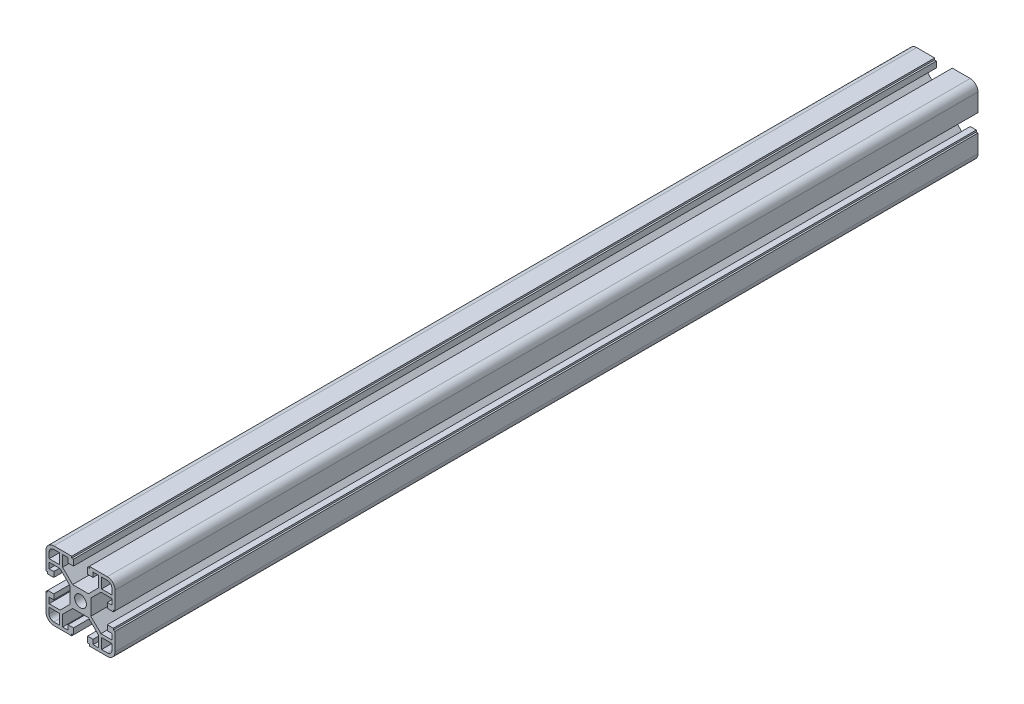
from build123d import *

# Parameters (mm, degrees)
SKETCH3_R           = 3.4
BOSS_EXTRUDE1_DEPTH = 500


with BuildPart() as part:
    # Sketch3 → Boss-Extrude1 (new body)
    with BuildSketch(Plane.XY):
        with BuildLine():
            Line((-11.814213562, 10.4), (-6, 4.585786438))
            Line((-6, 4.585786438), (-6, -4.585786438))
            Line((-6, -4.585786438), (-11.814213562, -10.4))
            Line((-11.814213562, -10.4), (-18.2, -10.4))
            Line((-18.2, -10.4), (-18.2, -7.1))
            Line((-18.2, -7.1), (-15.5, -7.1))
            Line((-15.5, -7.1), (-15.5, -4.1))
            Line((-15.5, -4.1), (-19, -4.1))
            Line((-19, -4.1), (-19, -5.1))
            Line((-19, -5.1), (-20, -5.1))
            Line((-20, -5.1), (-20, -15.5))
            ThreePointArc((-20, -15.5), (-18.681980515, -18.681980515), (-15.5, -20))
            Line((-15.5, -20), (-5.1, -20))
            Line((-5.1, -20), (-5.1, -19))
            Line((-5.1, -19), (-4.1, -19))
            Line((-4.1, -19), (-4.1, -15.5))
            Line((-4.1, -15.5), (-7.258114106, -15.5))
            Line((-7.258114106, -15.5), (-7.258114106, -18.2))
            Line((-7.258114106, -18.2), (-10.4, -18.2))
            Line((-10.4, -18.2), (-10.4, -11.814213562))
            Line((-10.4, -11.814213562), (-4.585786438, -6))
            Line((-4.585786438, -6), (4.585786438, -6))
            Line((4.585786438, -6), (10.4, -11.814213562))
            Line((10.4, -11.814213562), (10.4, -18.2))
            Line((10.4, -18.2), (7.258114106, -18.2))
            Line((7.258114106, -18.2), (7.258114106, -15.5))
            Line((7.258114106, -15.5), (4.1, -15.5))
            Line((4.1, -15.5), (4.1, -19))
            Line((4.1, -19), (5.1, -19))
            Line((5.1, -19), (5.1, -20))
            Line((5.1, -20), (15.5, -20))
            ThreePointArc((15.5, -20), (18.681980515, -18.681980515), (20, -15.5))
            Line((20, -15.5), (20, -5.1))
            Line((20, -5.1), (19, -5.1))
            Line((19, -5.1), (19, -4.1))
            Line((19, -4.1), (15.5, -4.1))
            Line((15.5, -4.1), (15.5, -7.1))
            Line((15.5, -7.1), (18.2, -7.1))
            Line((18.2, -7.1), (18.2, -10.4))
            Line((18.2, -10.4), (11.814213562, -10.4))
            Line((11.814213562, -10.4), (6, -4.585786438))
            Line((6, -4.585786438), (6, 4.585786438))
            Line((6, 4.585786438), (11.814213562, 10.4))
            Line((11.814213562, 10.4), (18.2, 10.4))
            Line((18.2, 10.4), (18.2, 7.1))
            Line((18.2, 7.1), (15.5, 7.1))
            Line((15.5, 7.1), (15.5, 4.1))
            Line((15.5, 4.1), (19, 4.1))
            Line((19, 4.1), (19, 5.1))
            Line((19, 5.1), (20, 5.1))
            Line((20, 5.1), (20, 15.5))
            ThreePointArc((20, 15.5), (18.681980515, 18.681980515), (15.5, 20))
            Line((15.5, 20), (5.1, 20))
            Line((5.1, 20), (5.1, 19))
            Line((5.1, 19), (4.1, 19))
            Line((4.1, 19), (4.1, 15.5))
            Line((4.1, 15.5), (7.258114106, 15.5))
            Line((7.258114106, 15.5), (7.258114106, 18.2))
            Line((7.258114106, 18.2), (10.4, 18.2))
            Line((10.4, 18.2), (10.4, 11.814213562))
            Line((10.4, 11.814213562), (4.585786438, 6))
            Line((4.585786438, 6), (-4.585786438, 6))
            Line((-4.585786438, 6), (-10.4, 11.814213562))
            Line((-10.4, 11.814213562), (-10.4, 18.2))
            Line((-10.4, 18.2), (-7.258114106, 18.2))
            Line((-7.258114106, 18.2), (-7.258114106, 15.5))
            Line((-7.258114106, 15.5), (-4.1, 15.5))
            Line((-4.1, 15.5), (-4.1, 19))
            Line((-4.1, 19), (-5.1, 19))
            Line((-5.1, 19), (-5.1, 20))
            Line((-5.1, 20), (-15.5, 20))
            ThreePointArc((-15.5, 20), (-18.681980515, 18.681980515), (-20, 15.5))
            Line((-20, 15.5), (-20, 5.1))
            Line((-20, 5.1), (-19, 5.1))
            Line((-19, 5.1), (-19, 4.1))
            Line((-19, 4.1), (-15.5, 4.1))
            Line((-15.5, 4.1), (-15.5, 7.1))
            Line((-15.5, 7.1), (-18.2, 7.1))
            Line((-18.2, 7.1), (-18.2, 10.4))
            Line((-18.2, 10.4), (-11.814213562, 10.4))
        make_face()
        with BuildLine():
            Line((-18.2, -15.5), (-18.2, -12.2))
            Line((-18.2, -12.2), (-12.2, -12.2))
            Line((-12.2, -12.2), (-12.2, -18.2))
            Line((-12.2, -18.2), (-15.5, -18.2))
            ThreePointArc((-15.5, -18.2), (-17.409188309, -17.409188309), (-18.2, -15.5))
        make_face(mode=Mode.SUBTRACT)
        Circle(SKETCH3_R, mode=Mode.SUBTRACT)
        with BuildLine():
            Line((-18.2, 12.2), (-18.2, 15.5))
            ThreePointArc((-18.2, 15.5), (-17.409188309, 17.409188309), (-15.5, 18.2))
            Line((-15.5, 18.2), (-12.2, 18.2))
            Line((-12.2, 18.2), (-12.2, 12.2))
            Line((-12.2, 12.2), (-18.2, 12.2))
        make_face(mode=Mode.SUBTRACT)
        with BuildLine():
            Line((18.2, 15.5), (18.2, 12.2))
            Line((18.2, 12.2), (12.2, 12.2))
            Line((12.2, 12.2), (12.2, 18.2))
            Line((12.2, 18.2), (15.5, 18.2))
            ThreePointArc((15.5, 18.2), (17.409188309, 17.409188309), (18.2, 15.5))
        make_face(mode=Mode.SUBTRACT)
        with BuildLine():
            Line((12.2, -18.2), (12.2, -12.2))
            Line((12.2, -12.2), (18.2, -12.2))
            Line((18.2, -12.2), (18.2, -15.5))
            ThreePointArc((18.2, -15.5), (17.409188309, -17.409188309), (15.5, -18.2))
            Line((15.5, -18.2), (12.2, -18.2))
        make_face(mode=Mode.SUBTRACT)
    extrude(amount=BOSS_EXTRUDE1_DEPTH)


solid = part.part
